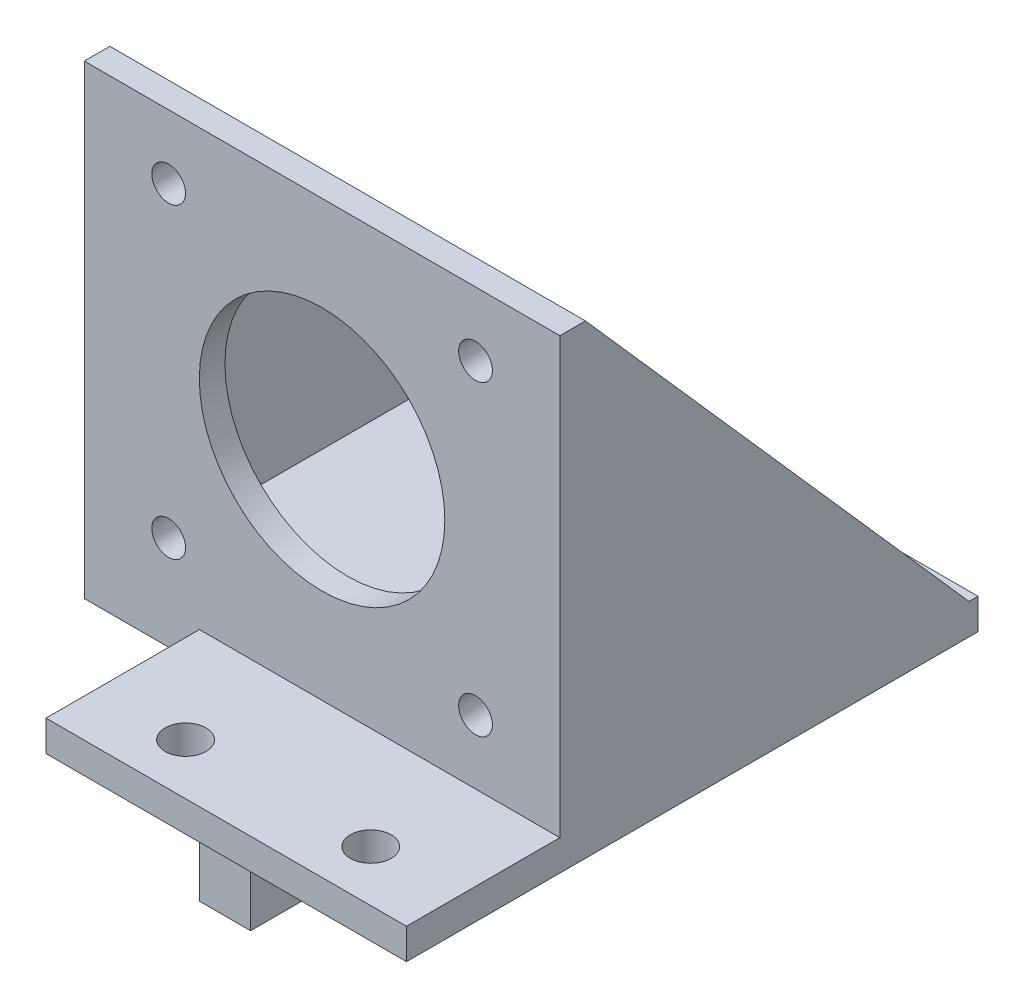
from build123d import *

# Parameters (mm, degrees)
SKETCH1_R           = 2
BOSS_EXTRUDE1_DEPTH = 3
BOSS_EXTRUDE2_DEPTH = 42.5
CUT_EXTRUDE1_DEPTH  = 77.832667384
SKETCH4_R           = 12
SKETCH4_R_2         = 1.65
CUT_EXTRUDE2_DEPTH  = 82.92227278
SKETCH6_W           = 5
SKETCH6_H           = 40.874916237
BOSS_EXTRUDE3_DEPTH = 20
SKETCH7_R           = 2.025
CUT_EXTRUDE4_DEPTH  = 69.231144603


with BuildPart() as part:
    # Sketch1 → Boss-Extrude1 (new body)
    with BuildSketch(Plane(origin=(0, 0, 0), x_dir=(1, 0, 0), z_dir=(0, 1, 0))):
        Polygon((54.5, 0.874916237), (54.5, 40.874916237), (8, 40.874916237), (8, 0), (19.259624399, 0), (19.259624399, -15), (54.5, -15), align=None)
        with Locations(Location((27.904171313, -10, 0), (0, 0, 270))):
            Circle(SKETCH1_R, mode=Mode.SUBTRACT)
        with Locations(Location((46.009358787, -10, 0), (0, 0, 270))):
            Circle(SKETCH1_R, mode=Mode.SUBTRACT)
    extrude(amount=BOSS_EXTRUDE1_DEPTH)

    # Sketch2 → Boss-Extrude2 (add)
    with BuildSketch(Plane(origin=(0, 3, 0), x_dir=(1, 0, 0), z_dir=(0, 1, 0))):
        Polygon((10, 2.5), (10, 40), (8, 40), (8, 0), (54.5, 0), (54.5, 40), (52.5, 40), (52.5, 2.5), align=None)
    extrude(amount=BOSS_EXTRUDE2_DEPTH)

    # Sketch3 → Cut-Extrude1 (cut, through all)
    with BuildSketch(Plane(origin=(54.5, 0, 0), x_dir=(0, 0, -1), z_dir=(1, 0, 0))):
        Polygon((40, 45.5), (2.5, 45.5), (40, 3), align=None)
    extrude(amount=-CUT_EXTRUDE1_DEPTH, mode=Mode.SUBTRACT)

    # Sketch4 → Cut-Extrude2 (cut, through all)
    with BuildSketch(Plane.XY):
        with Locations((31.25, 24.25)):
            Circle(SKETCH4_R)
        with Locations((16.25, 9.25)):
            Circle(SKETCH4_R_2)
        with Locations((16.25, 39.25)):
            Circle(SKETCH4_R_2)
        with Locations((46.25, 39.25)):
            Circle(SKETCH4_R_2)
        with Locations((46.25, 9.25)):
            Circle(SKETCH4_R_2)
    extrude(amount=-CUT_EXTRUDE2_DEPTH, mode=Mode.SUBTRACT)

    # Sketch6 → Boss-Extrude3 (add)
    with BuildSketch(Plane.XZ):
        with Locations((21.759624399, -20.437458119)):
            Rectangle(SKETCH6_W, SKETCH6_H)
    extrude(amount=BOSS_EXTRUDE3_DEPTH)

    # Sketch7 → Cut-Extrude4 (cut, through all)
    with BuildSketch(Plane(origin=(24.259624399, 0, 0), x_dir=(0, 0, -1), z_dir=(1, 0, 0))):
        with Locations((35, -10)):
            Circle(SKETCH7_R)
        with Locations((20, -10)):
            Circle(SKETCH7_R)
        with Locations((5, -10)):
            Circle(SKETCH7_R)
    extrude(amount=-CUT_EXTRUDE4_DEPTH, mode=Mode.SUBTRACT)


solid = part.part
